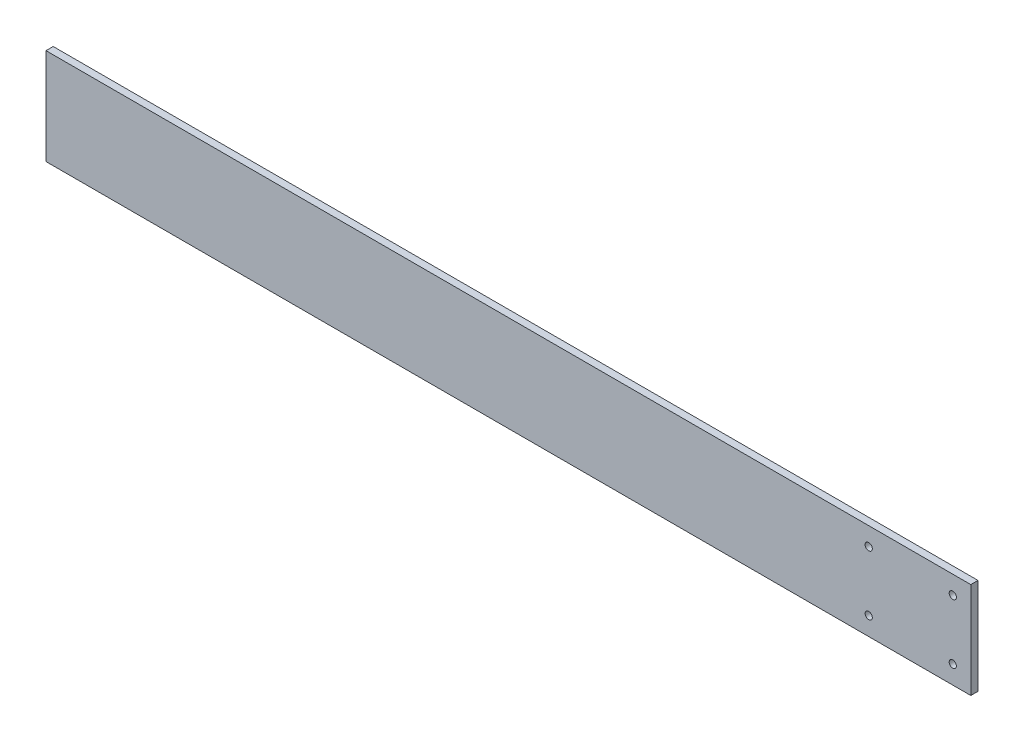
from build123d import *

# Parameters (mm, degrees)
SKETCH1_W               = 385
SKETCH1_H               = 40
BOSS_EXTRUDE1_DEPTH     = 3
CUT_EXTRUDE2_DEPTH      = 194.5594224
CUT_EXTRUDE2_DEPTH_BACK = 194.5594224
SKETCH2_R               = 1.5


with BuildPart() as part:
    # Sketch1 → Boss-Extrude1 (new body)
    with BuildSketch(Plane.XY):
        Rectangle(SKETCH1_W, SKETCH1_H)
    extrude(amount=BOSS_EXTRUDE1_DEPTH)

    # Sketch2 → Cut-Extrude2 (cut, two sides: drawn at the far end of the back side and taken through both)
    with BuildSketch(Plane.XY.offset(3).offset(-CUT_EXTRUDE2_DEPTH_BACK)):
        with Locations((185, 12.420635604)):
            Circle(SKETCH2_R)
        with Locations(Location((185, -12.420635604, 0), (0, 0, 180))):
            Circle(SKETCH2_R)
        with Locations((150, -12.420635604)):
            Circle(SKETCH2_R)
        with Locations(Location((150, 12.420635604, 0), (0, 0, 180))):
            Circle(SKETCH2_R)
    extrude(amount=CUT_EXTRUDE2_DEPTH + CUT_EXTRUDE2_DEPTH_BACK, mode=Mode.SUBTRACT)


solid = part.part
